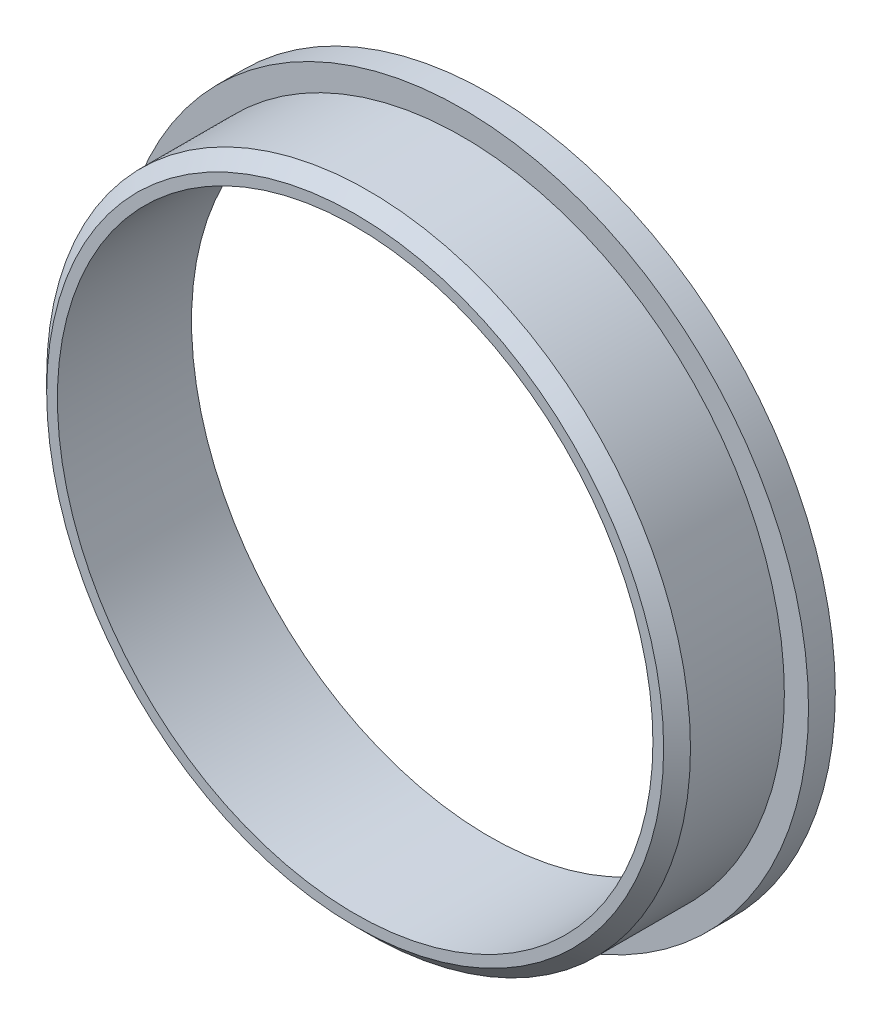
from build123d import *

# Parameters (mm, degrees)
SKETCH_1_R          = 12.9
SKETCH_1_R_2        = 11.1
EXTRUDE_1_DEPTH     = 5
SKETCH_3_R          = 16.662816376
SKETCH_3_R_2        = 12
CUT_EXTRUDE_1_DEPTH = 4
CHAMFER_1_SIZE      = 0.5


with BuildPart() as part:
    # 草图1 → 凸台-拉伸1 (new body)
    with BuildSketch(Plane.XY):
        Circle(SKETCH_1_R)
        Circle(SKETCH_1_R_2, mode=Mode.SUBTRACT)
    extrude(amount=EXTRUDE_1_DEPTH)

    # 草图3 → 切除-拉伸1 (cut)
    with BuildSketch(Plane.XY.offset(5)):
        Circle(SKETCH_3_R)
        Circle(SKETCH_3_R_2, mode=Mode.SUBTRACT)
    extrude(amount=-CUT_EXTRUDE_1_DEPTH, mode=Mode.SUBTRACT)

    # 倒角1
    chamfer_1_edges = [part.edges().sort_by_distance(p)[0] for p in [
        (-12, 0, 5),
    ]]
    chamfer(chamfer_1_edges, length=CHAMFER_1_SIZE)


solid = part.part
